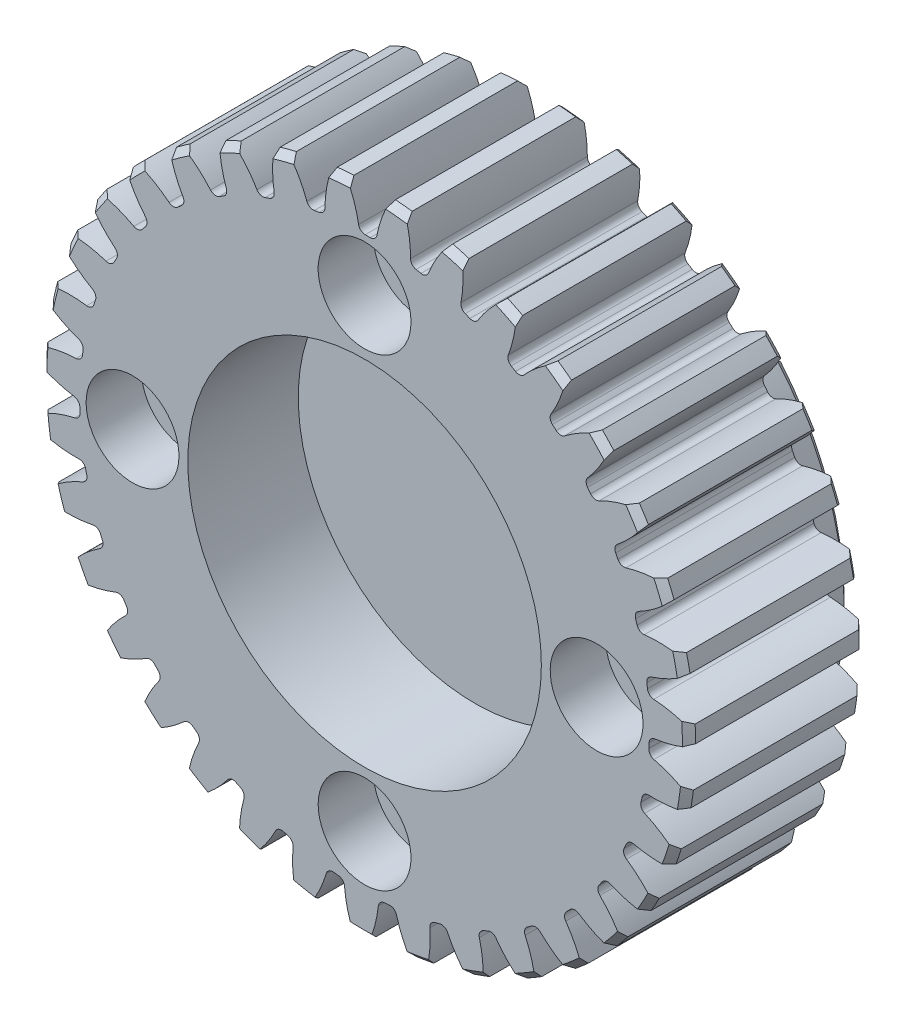
from build123d import *

# Parameters (mm, degrees)
SKETCH3_R           = 14.684375
GEARBODY_DEPTH      = 8
CHAMFER2_SIZE       = 0.3
TOOTHCUT_DEPTH      = 23.254476814
CIRPATTERN1_COUNT   = 35
BOSS_EXTRUDE1_DEPTH = 1.4
CHAMFER1_SIZE       = 0.3
SKETCH5_R           = 2.1
CUT_EXTRUDE1_DEPTH  = 2.2
SKETCH6_R           = 8
CUT_EXTRUDE2_DEPTH  = 5
SKETCH7_R           = 2.1
CUT_EXTRUDE3_DEPTH  = 2.5
CIRPATTERN2_COUNT   = 4


with BuildPart() as part:
    # Sketch3 → gearBody (new body)
    with BuildSketch(Plane.XY):
        Circle(SKETCH3_R)
    extrude(amount=GEARBODY_DEPTH)

    # Chamfer2
    chamfer2_edges = [part.edges().sort_by_distance(p)[0] for p in [
        (-14.684375, 0, 0),
        (-14.684375, 0, 8),
    ]]
    chamfer(chamfer2_edges, length=CHAMFER2_SIZE)

    # Sketch2 → toothCut (cut, through all)
    with BuildSketch(Plane.XY):
        with BuildLine():
            ThreePointArc((12.860420219, -0.832308497), (12.867245698, -0.719120159), (12.873074992, -0.605876147))
            ThreePointArc((12.873074992, -0.605876147), (12.953000977, -0.41446631), (13.137160632, -0.319014173))
            ThreePointArc((13.137160632, -0.319014173), (15.309785265, 0.450259807), (16.977880176, 2.040712454))
            ThreePointArc((16.977880176, 2.040712454), (17.073442395, -0.95419462), (16.644760961, -3.919802946))
            ThreePointArc((16.644760961, -3.919802946), (15.164273756, -2.153383435), (13.090897044, -1.146810406))
            ThreePointArc((13.090897044, -1.146810406), (12.918520197, -1.031432281), (12.860420219, -0.832308497))
        make_face()
    toothcut = extrude(amount=TOOTHCUT_DEPTH, mode=Mode.SUBTRACT)

    # CirPattern1: toothCut ×35 about axis
    cirpattern1_axis = Axis((0, 0, 0), (0, 0, 1))
    for i in range(1, CIRPATTERN1_COUNT):
        add(toothcut.rotate(cirpattern1_axis, i * 360 / CIRPATTERN1_COUNT), mode=Mode.SUBTRACT)

    # Sketch4 → Boss-Extrude1 (add)
    with BuildSketch(Plane(origin=(0, 0, 0), x_dir=(-1, 0, 0), z_dir=(0, 0, -1))):
        with BuildLine():
            Line((-9.566608594, 8.2), (9.566608594, 8.2))
            ThreePointArc((9.566608594, 8.2), (0, -12.6), (-9.566608594, 8.2))
        make_face()
    extrude(amount=BOSS_EXTRUDE1_DEPTH)

    # Chamfer1
    chamfer1_edges = [part.edges().sort_by_distance(p)[0] for p in [
        (0, -12.6, -1.4),
        (0, 8.2, -1.4),
    ]]
    chamfer(chamfer1_edges, length=CHAMFER1_SIZE)

    # Sketch5 → Cut-Extrude1 (cut)
    with BuildSketch(Plane(origin=(0, 0, -1.4), x_dir=(-1, 0, 0), z_dir=(0, 0, -1))):
        with Locations((0, -6)):
            Circle(SKETCH5_R)
    extrude(amount=-CUT_EXTRUDE1_DEPTH, mode=Mode.SUBTRACT)

    # Sketch6 → Cut-Extrude2 (cut)
    with BuildSketch(Plane.XY.offset(8)):
        Circle(SKETCH6_R)
    extrude(amount=-CUT_EXTRUDE2_DEPTH, mode=Mode.SUBTRACT)

    # Sketch7 → Cut-Extrude3 (cut)
    with BuildSketch(Plane.XY.offset(8)):
        with Locations((0, 10.5)):
            Circle(SKETCH7_R)
    cut_extrude3 = extrude(amount=-CUT_EXTRUDE3_DEPTH, mode=Mode.SUBTRACT)

    # CirPattern2: Cut-Extrude3 ×4 about axis
    cirpattern2_axis = Axis((0, 0, 0), (0, 0, 1))
    for i in range(1, CIRPATTERN2_COUNT):
        add(cut_extrude3.rotate(cirpattern2_axis, i * 360 / CIRPATTERN2_COUNT), mode=Mode.SUBTRACT)


solid = part.part
